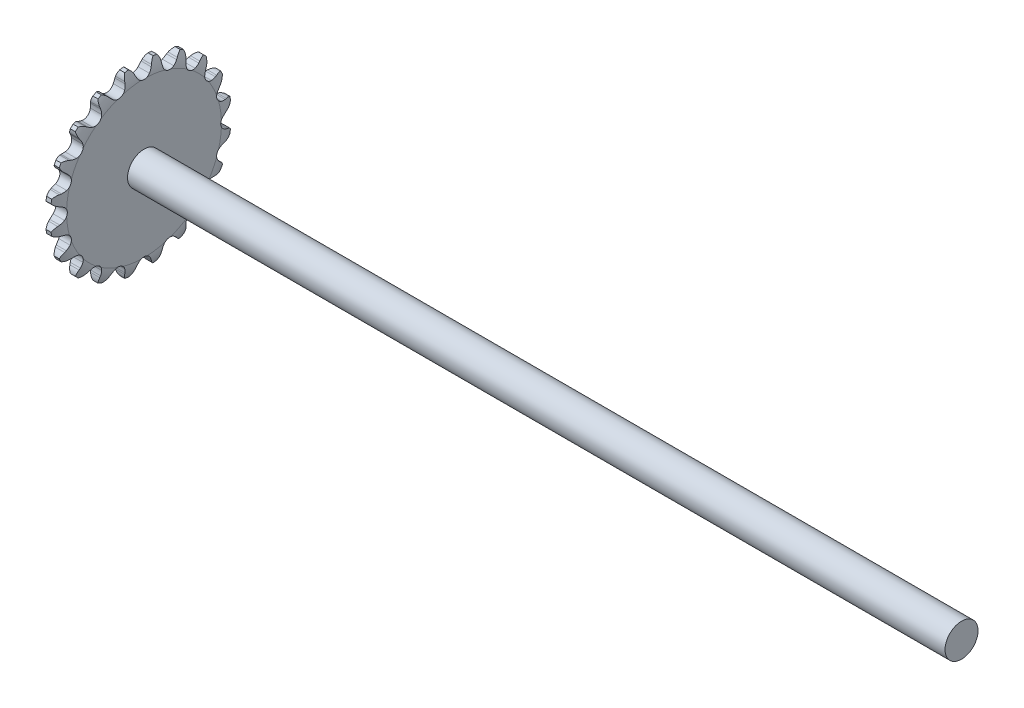
from build123d import *

# Parameters (mm, degrees)
TOOTHCUT_DEPTH      = 32.169679271
TEETHCUTS_COUNT     = 20
TEETHCUTS_ANGLE     = 342
BORSKE_R            = 4
BORE_DEPTH          = 50.8000508
BOSS_EXTRUDE1_START = -201
SKETCH1_R           = 4
BOSS_EXTRUDE1_DEPTH = 201


with BuildPart() as part:
    # BasProSke → Base-Revolve (revolve)
    with BuildSketch(Plane(origin=(0, 0, 0), x_dir=(1, 0, 0), z_dir=(0, 1, 0)), mode=Mode.PRIVATE) as base_revolve_sk:
        with BuildLine():
            Line((0, 0), (0, 18.776161082))
            ThreePointArc((0, 18.776161082), (0.199787117, 20.411751477), (0.7874, 21.951161082))
            Line((0.7874, 21.951161082), (2.01295, 21.951161082))
            ThreePointArc((2.01295, 21.951161082), (2.600562883, 20.411751477), (2.80035, 18.776161082))
            Line((2.80035, 18.776161082), (2.80035, 0))
            Line((2.80035, 0), (0, 0))
        make_face()
    revolve(base_revolve_sk.sketch.rotate(Axis((-10, 0, 0), (1, 0, 0)), 180), axis=Axis((-10, 0, 0), (1, 0, 0)))

    # TooCutSke → ToothCut (cut, through all)
    with BuildSketch(Plane(origin=(0, 0, 0), x_dir=(0, 0, -1), z_dir=(1, 0, 0))):
        with BuildLine():
            Line((1.918313524, 20.240957663), (2.077231161, 20.619007781))
            ThreePointArc((2.077231161, 20.619007781), (3.071954195, 21.821421376), (4.565885661, 22.272465878))
            ThreePointArc((4.565885661, 22.272465878), (0, 22.735655877), (-4.565885661, 22.272465878))
            ThreePointArc((-4.565885661, 22.272465878), (-3.071954195, 21.821421376), (-2.077231161, 20.619007781))
            Line((-2.077231161, 20.619007781), (-1.918313524, 20.240957663))
            ThreePointArc((-1.918313524, 20.240957663), (-1.660798791, 19.726712623), (-1.337533993, 19.251042918))
            ThreePointArc((-1.337533993, 19.251042918), (0, 18.598684001), (1.337533993, 19.251042918))
            ThreePointArc((1.337533993, 19.251042918), (1.660798791, 19.726712623), (1.918313524, 20.240957663))
        make_face()
    toothcut = extrude(amount=TOOTHCUT_DEPTH, mode=Mode.SUBTRACT)

    # TeethCuts: ToothCut ×20 about axis
    teethcuts_axis = Axis((-10, 0, 0), (1, 0, 0))
    for i in range(1, TEETHCUTS_COUNT):
        add(toothcut.rotate(teethcuts_axis, i * TEETHCUTS_ANGLE / (TEETHCUTS_COUNT - 1)), mode=Mode.SUBTRACT)

    # BorSke → Bore (cut, symmetric)
    with BuildSketch(Plane(origin=(0, 0, 0), x_dir=(0, 0, -1), z_dir=(1, 0, 0))):
        with Locations(Location((0, 0, 0), (0, 0, 180))):
            Circle(BORSKE_R)
    extrude(amount=BORE_DEPTH, both=True, mode=Mode.SUBTRACT)

    # Sketch1 → Boss-Extrude1 (add)
    with BuildSketch(Plane.ZY.offset(BOSS_EXTRUDE1_START)):
        Circle(SKETCH1_R)
    extrude(amount=BOSS_EXTRUDE1_DEPTH)


solid = part.part
